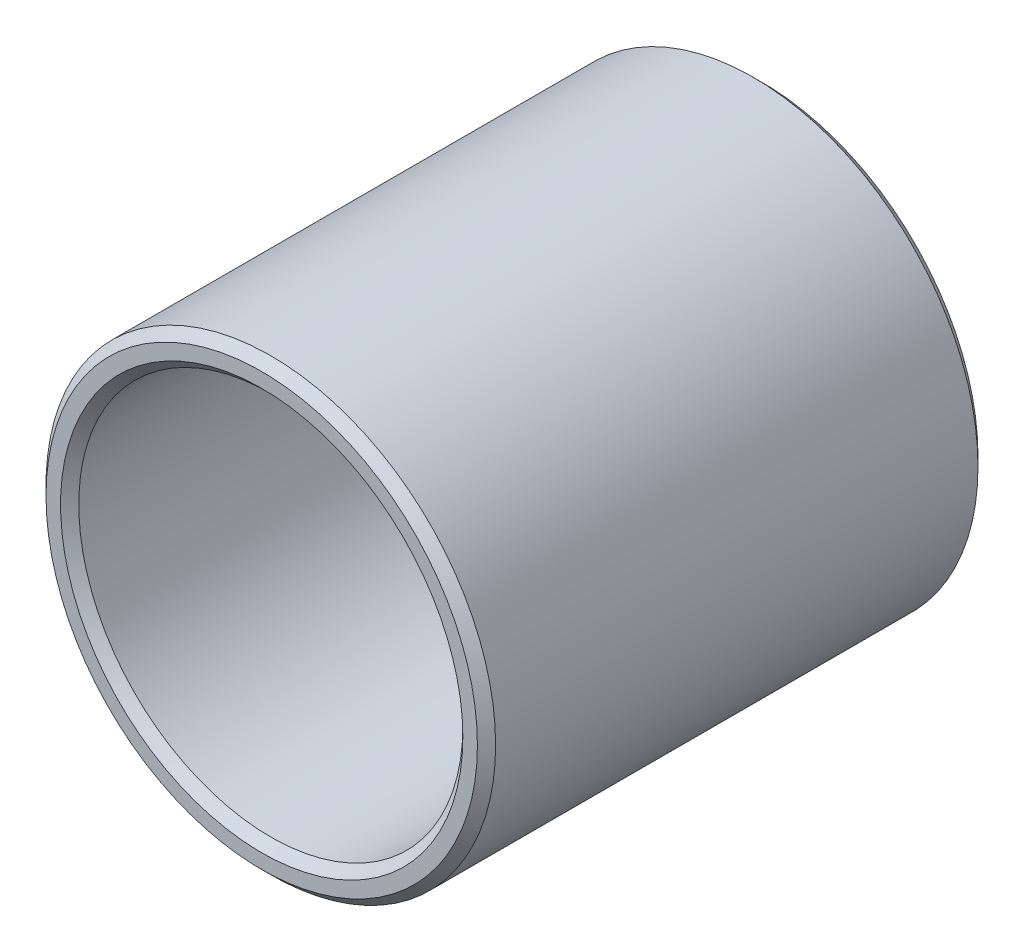
from build123d import *

# Parameters (mm, degrees)
SKIZZE1_R                       = 12.35
SKIZZE1_R_2                     = 10.55
AUFSATZ_LINEAR_AUSTRAGEN1_DEPTH = 13.75
FASE1_SIZE                      = 0.5


with BuildPart() as part:
    # Skizze1 → Aufsatz-Linear austragen1 (new, symmetric)
    with BuildSketch(Plane.XY):
        Circle(SKIZZE1_R)
        Circle(SKIZZE1_R_2, mode=Mode.SUBTRACT)
    extrude(amount=AUFSATZ_LINEAR_AUSTRAGEN1_DEPTH, both=True)

    # Fase1
    fase1_edges = [part.edges().sort_by_distance(p)[0] for p in [
        (-12.35, 0, -13.75),
        (-12.35, 0, 13.75),
        (-10.55, 0, -13.75),
        (-10.55, 0, 13.75),
    ]]
    chamfer(fase1_edges, length=FASE1_SIZE)


solid = part.part
